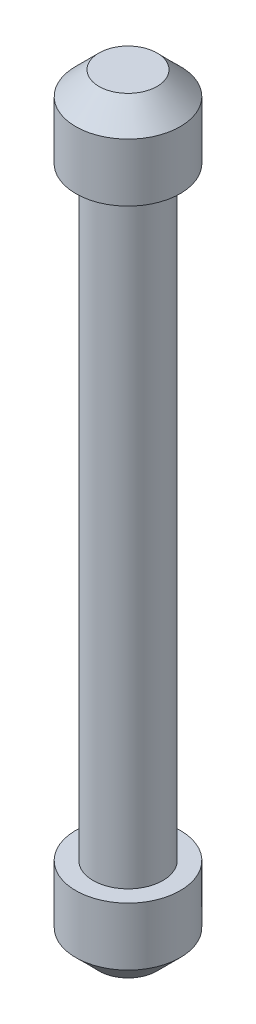
from build123d import *

# Parameters (mm, degrees)
SKETCH1_R           = 2.25
BOSS_EXTRUDE1_DEPTH = 3.5
SKETCH2_R           = 1.5
BOSS_EXTRUDE2_DEPTH = 26
BOSS_EXTRUDE3_START = 3.5
SKETCH3_R           = 2.25
BOSS_EXTRUDE3_DEPTH = 3.5
CHAMFER1_SIZE       = 1


with BuildPart() as part:
    # Sketch1 → Boss-Extrude1 (new body)
    with BuildSketch(Plane(origin=(0, 0, 0), x_dir=(1, 0, 0), z_dir=(0, 1, 0))):
        with Locations(Location((0, 0, 0), (0, 0, 270))):
            Circle(SKETCH1_R)
    extrude(amount=BOSS_EXTRUDE1_DEPTH)

    # Sketch2 → Boss-Extrude2 (add)
    with BuildSketch(Plane.XZ):
        with Locations(Location((0, 0, 0), (0, 0, 90))):
            Circle(SKETCH2_R)
    extrude(amount=BOSS_EXTRUDE2_DEPTH)

    # Sketch3 → Boss-Extrude3 (add)
    with BuildSketch(Plane.XZ.offset(26).offset(BOSS_EXTRUDE3_START)):
        with Locations(Location((0, 0, 0), (0, 0, 90))):
            Circle(SKETCH3_R)
    extrude(amount=-BOSS_EXTRUDE3_DEPTH)

    # Chamfer1
    chamfer1_edges = [part.edges().sort_by_distance(p)[0] for p in [
        (0, -29.5, -2.25),
        (0, 3.5, -2.25),
    ]]
    chamfer(chamfer1_edges, length=CHAMFER1_SIZE)


solid = part.part
